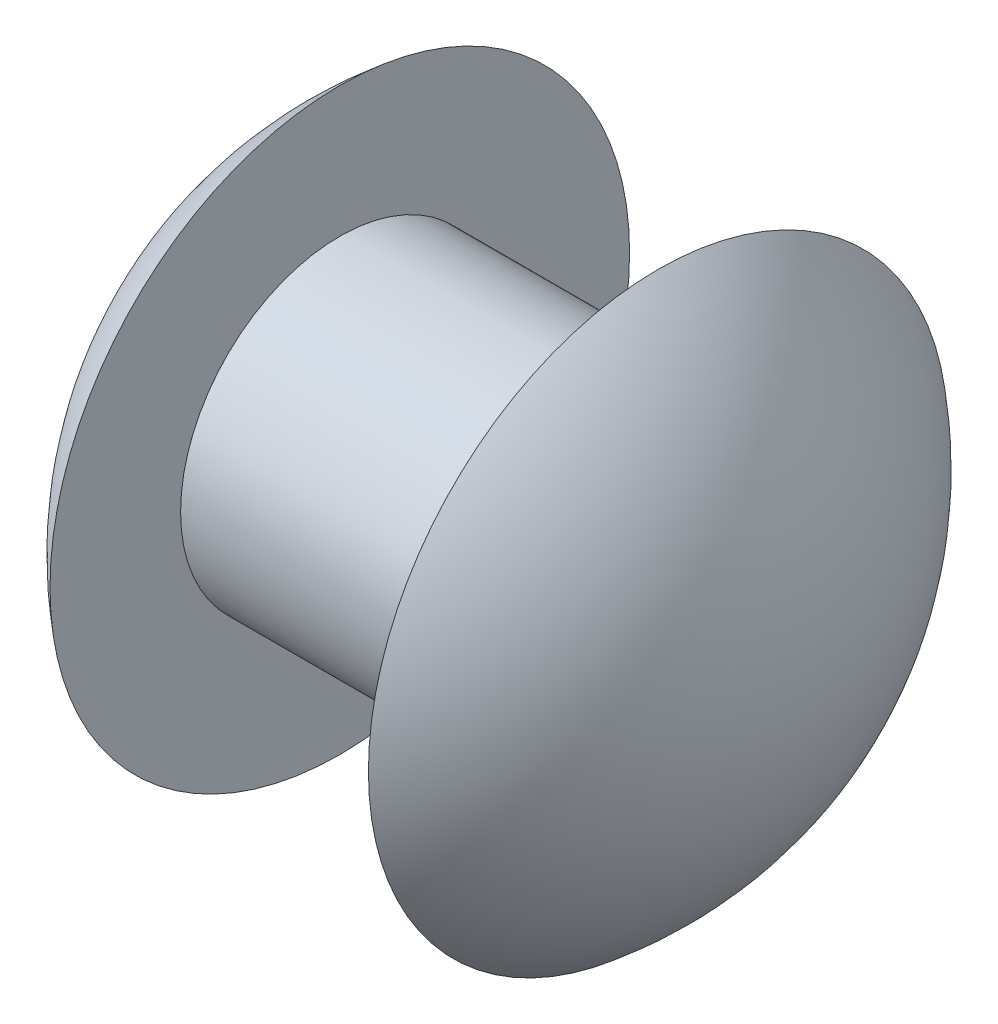
from build123d import *


with BuildPart() as part:
    # Эскиз1 → Повернуть1 (revolve)
    with BuildSketch(Plane.XY):
        with BuildLine():
            Line((-0.017667155, 1.5), (-0.017667155, 2.730271717))
            ThreePointArc((-0.017667155, 2.730271717), (-0.983297624, 1.514164206), (-1.327777579, 0))
            Line((-1.327777579, 0), (4.29244327, 0))
            ThreePointArc((4.29244327, 0), (3.947963315, 1.514164206), (2.982332845, 2.730271717))
            Line((2.982332845, 2.730271717), (2.982332845, 1.5))
            Line((2.982332845, 1.5), (-0.017667155, 1.5))
        make_face()
    revolve(axis=Axis((-49.423517382, 0, 0), (1, 0, 0)))


solid = part.part
